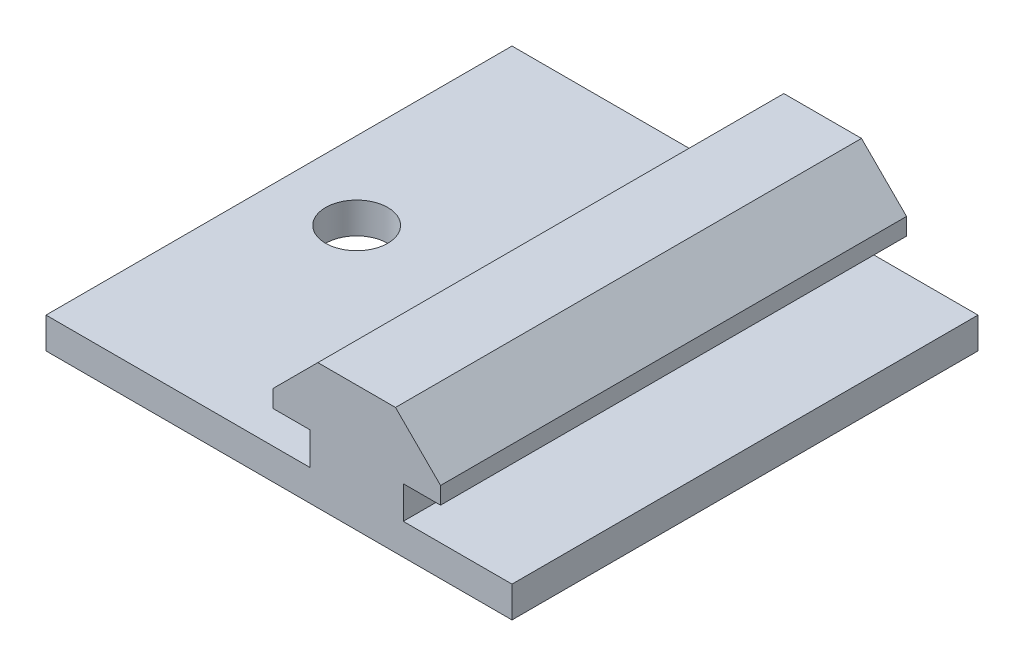
from build123d import *

# Parameters (mm, degrees)
BOSS_EXTRUDE2_DEPTH = 15
SKETCH4_R           = 2
CUT_EXTRUDE1_DEPTH  = 32.483487736


with BuildPart() as part:
    # Sketch2 → Boss-Extrude2 (new, symmetric)
    with BuildSketch(Plane.XY):
        Polygon((5.4, 3.2), (2.5, 6.1), (-2.5, 6.1), (-5.4, 3.2), (-5.4, 2.1), (-3, 2.1), (-3, 0), (-20, 0), (-20, -2), (10, -2), (10, 0), (3, 0), (3, 2.1), (5.4, 2.1), align=None)
    extrude(amount=BOSS_EXTRUDE2_DEPTH, both=True)

    # Sketch4 → Cut-Extrude1 (cut, through all)
    with BuildSketch(Plane(origin=(7, 0, 0), x_dir=(0, 0, 1), z_dir=(0, -1, 0))):
        with Locations(Location((0, 22, 0), (0, 0, 180))):
            Circle(SKETCH4_R)
    extrude(amount=CUT_EXTRUDE1_DEPTH, mode=Mode.SUBTRACT)


solid = part.part
